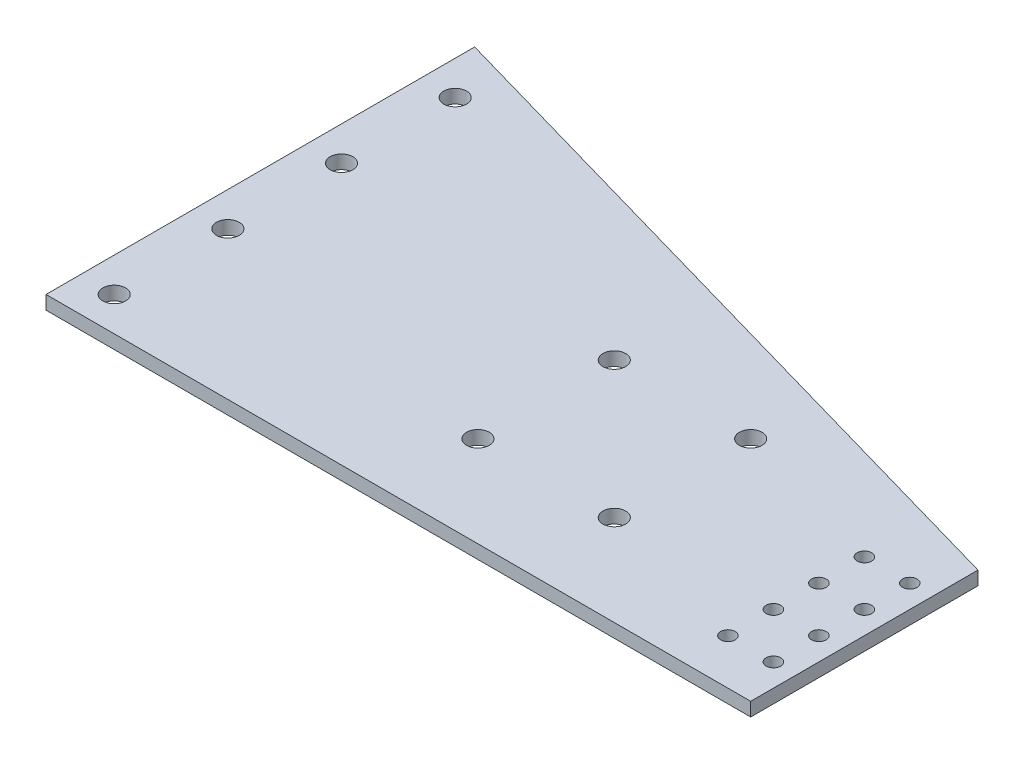
from build123d import *

# Parameters (mm, degrees)
EXTRUDE_1_DEPTH             = 3
HOLE_WIZARD_5_0_5_2_D       = 5
HOLE_WIZARD_5_0_5_1_D       = 5
HOLE_WIZARD_3_2_3_2_2_D     = 3.2
PATTERN_LINEAR_1_COUNT      = 4
PATTERN_LINEAR_1_PITCH      = 10
PATTERN_LINEAR_1_COUNT_DIR2 = 2
PATTERN_LINEAR_1_PITCH_DIR2 = 10


with BuildPart() as part:
    # 草图1 → 凸台-拉伸1 (new body)
    with BuildSketch(Plane(origin=(0, 0, 0), x_dir=(1, 0, 0), z_dir=(0, 1, 0))):
        Polygon((-85, -45), (70, -45), (70, 5), (-70, 45), (-85, 45), align=None)
        Polygon((-85, 45), (-70, 45), (-85, 49.285714286), align=None)
    extrude(amount=EXTRUDE_1_DEPTH)

    # Ø5.0 (5) 直径孔2 (through all)
    with Locations(Plane(origin=(0, 3, 0), x_dir=(1, 0, 0), z_dir=(0, 1, 0))):
        with Locations((-77.5, -37.5), (-77.5, -12.5), (-77.5, 37.5), (-77.5, 12.5)):
            Hole(HOLE_WIZARD_5_0_5_2_D / 2)

    # Ø5.0 (5) 直径孔1 (through all)
    with Locations(Plane(origin=(0, 0, 0), x_dir=(-1, 0, 0), z_dir=(0, -1, 0))):
        with Locations((10, -25), (10, 5), (-20, 5), (-20, -25)):
            Hole(HOLE_WIZARD_5_0_5_1_D / 2)

    # Ø3.2 (3.2) 直径孔2 (through all)
    with Locations(Plane(origin=(0, 0, 0), x_dir=(-1, 0, 0), z_dir=(0, -1, 0))):
        with Locations((-65, -35)):
            hole_wizard_3_2_3_2_2 = Hole(HOLE_WIZARD_3_2_3_2_2_D / 2)

    # 阵列(线性)1: Hole Wizard 3.2 _3.2_ _2 4 × 2
    with Locations(*[(-j * PATTERN_LINEAR_1_PITCH_DIR2, 0, -i * PATTERN_LINEAR_1_PITCH) for i in range(PATTERN_LINEAR_1_COUNT) for j in range(PATTERN_LINEAR_1_COUNT_DIR2) if (i, j) != (0, 0)]):
        add(hole_wizard_3_2_3_2_2, mode=Mode.SUBTRACT)


solid = part.part
